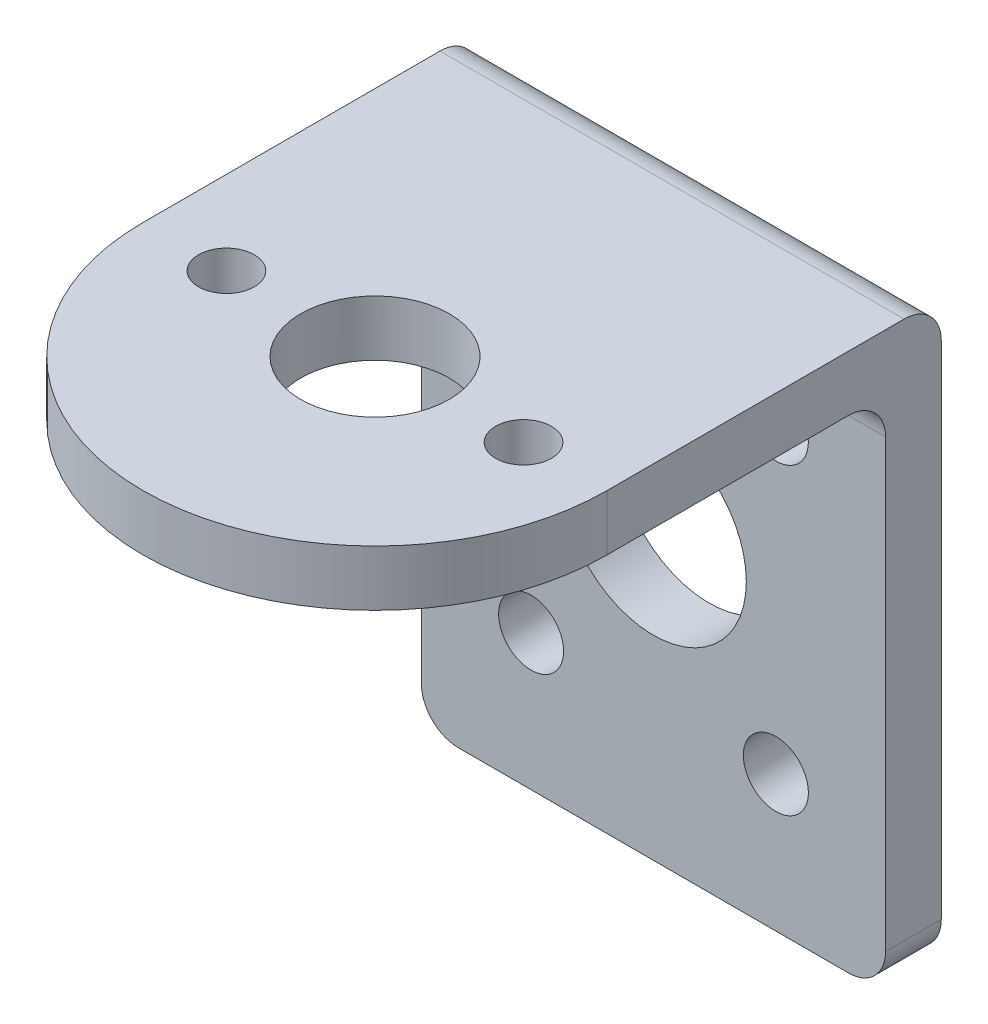
from build123d import *

# Parameters (mm, degrees)
ESQUISSE1_W             = 25
ESQUISSE1_H             = 31
ESQUISSE1_R             = 5
ESQUISSE1_R_2           = 1.75
BOSS_EXTRU_1_DEPTH      = 3
ESQUISSE2_W             = 25
ESQUISSE2_H             = 3
BOSS_EXTRU_2_DEPTH      = 30
ESQUISSE3_R             = 4
ESQUISSE3_R_2           = 1.5
ENL_V_MAT_EXTRU_1_DEPTH = 30
CONG_1_R                = 2


with BuildPart() as part:
    # Esquisse1 → Boss.-Extru.1 (new body)
    with BuildSketch(Plane.XY):
        with Locations((12.5, -0.075620767)):
            Rectangle(ESQUISSE1_W, ESQUISSE1_H)
        with Locations((12.5, -0.075620767)):
            Circle(ESQUISSE1_R, mode=Mode.SUBTRACT)
        with Locations((19.091400737, 8.097716147)):
            Circle(ESQUISSE1_R_2, mode=Mode.SUBTRACT)
        with Locations(Location((5.908599263, 8.097716147, 0), (0, 0, 180))):
            Circle(ESQUISSE1_R_2, mode=Mode.SUBTRACT)
        with Locations(Location((19.091400737, -8.248957682, 0), (0, 0, 180))):
            Circle(ESQUISSE1_R_2, mode=Mode.SUBTRACT)
        with Locations((5.908599263, -8.248957682)):
            Circle(ESQUISSE1_R_2, mode=Mode.SUBTRACT)
    extrude(amount=BOSS_EXTRU_1_DEPTH)

    # Esquisse2 → Boss.-Extru.2 (add)
    with BuildSketch(Plane.XY.offset(3)):
        with Locations((12.5, 13.924379233)):
            Rectangle(ESQUISSE2_W, ESQUISSE2_H)
    extrude(amount=BOSS_EXTRU_2_DEPTH)

    # Esquisse3 → Enlèv. mat.-Extru.1 (cut)
    with BuildSketch(Plane.XZ.offset(-12.424379233)):
        with Locations((12.5, 18)):
            Circle(ESQUISSE3_R)
        with Locations((20.5, 18)):
            Circle(ESQUISSE3_R_2)
        with Locations(Location((4.5, 18, 0), (0, 0, 270))):
            Circle(ESQUISSE3_R_2)
        with BuildLine():
            Line((0, 18.000546853), (0, 33))
            Line((0, 33), (25.000000024, 33))
            Line((25.000000024, 33), (25.000000024, 18.000546853))
            ThreePointArc((25.000000024, 18.000546853), (12.500000012, 30.500546865), (0, 18.000546853))
        make_face()
    extrude(amount=-ENL_V_MAT_EXTRU_1_DEPTH, mode=Mode.SUBTRACT)

    # Congé1
    cong_1_edges = [part.edges().sort_by_distance(p)[0] for p in [
        (12.5, 12.424379233, 3),
        (12.5, 15.424379233, 0),
        (25, -15.575620767, 1.5),
        (0, -15.575620767, 1.5),
    ]]
    fillet(cong_1_edges, radius=CONG_1_R)


solid = part.part
